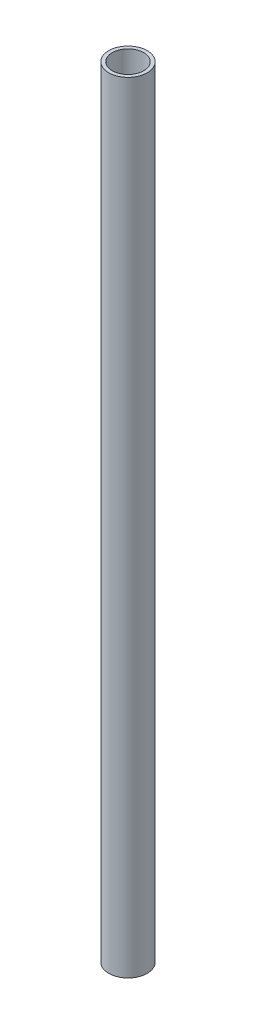
from build123d import *

# Parameters (mm, degrees)
SKETCH1_R           = 21.082
SKETCH1_R_2         = 17.272
BOSS_EXTRUDE1_DEPTH = 855.6625


with BuildPart() as part:
    # Sketch1 → Boss-Extrude1 (new body)
    with BuildSketch(Plane(origin=(0, 0, 0), x_dir=(1, 0, 0), z_dir=(0, 1, 0))):
        with Locations(Location((0, 0, 0), (0, 0, 270))):
            Circle(SKETCH1_R)
        with Locations(Location((0, 0, 0), (0, 0, 270))):
            Circle(SKETCH1_R_2, mode=Mode.SUBTRACT)
    extrude(amount=BOSS_EXTRUDE1_DEPTH)


solid = part.part
